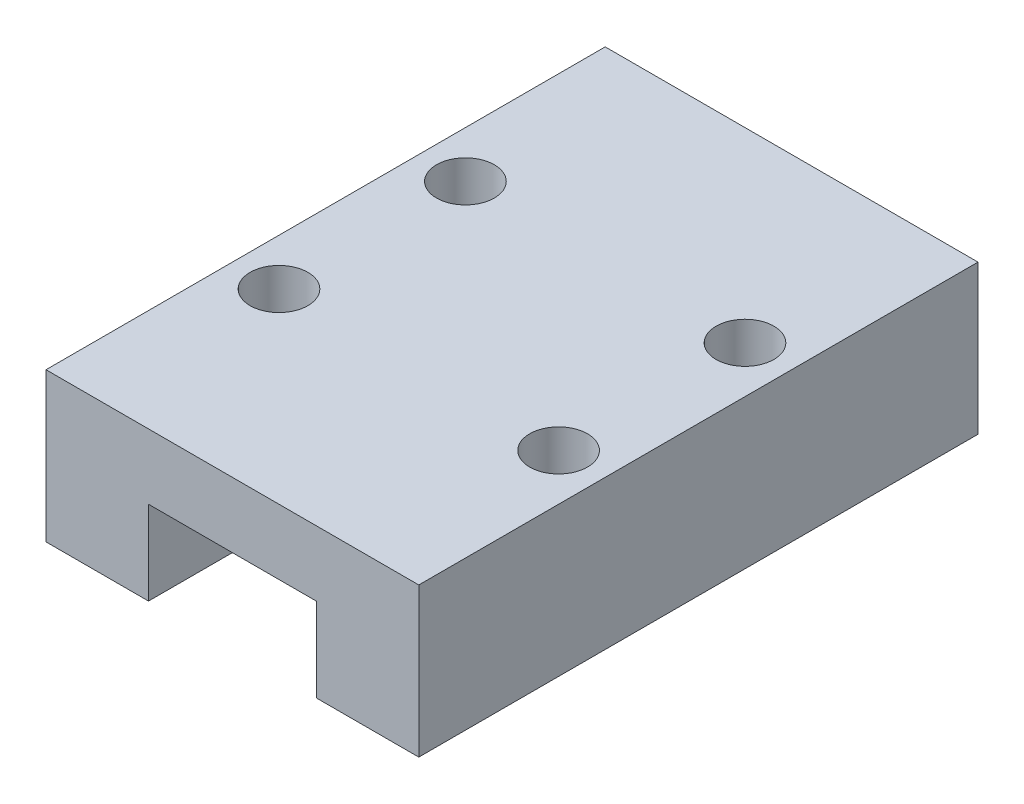
from build123d import *

# Parameters (mm, degrees)
SKETCH_1_W          = 20
SKETCH_1_H          = 30
EXTRUDE_1_DEPTH     = 3.5
SKETCH_2_W          = 5.5
SKETCH_2_H          = 30
EXTRUDE_2_DEPTH     = 4.5
SKETCH_3_R          = 1.55
CUT_EXTRUDE_1_DEPTH = 8


with BuildPart() as part:
    # 草图1 → 凸台-拉伸1 (new body)
    with BuildSketch(Plane(origin=(0, 0, 0), x_dir=(1, 0, 0), z_dir=(0, 1, 0))):
        Rectangle(SKETCH_1_W, SKETCH_1_H)
    extrude(amount=EXTRUDE_1_DEPTH)

    # 草图2 → 凸台-拉伸2 (add)
    with BuildSketch(Plane(origin=(0, 0, 0), x_dir=(-1, 0, 0), z_dir=(0, -1, 0))):
        with Locations((-7.25, 0)):
            Rectangle(SKETCH_2_W, SKETCH_2_H)
        with Locations((7.25, 0)):
            Rectangle(SKETCH_2_W, SKETCH_2_H)
    extrude(amount=EXTRUDE_2_DEPTH)

    # 草图3 → 切除-拉伸1 (cut)
    with BuildSketch(Plane(origin=(0, 3.5, 0), x_dir=(1, 0, 0), z_dir=(0, 1, 0))):
        with Locations(Location((-7.5, -5, 0), (0, 0, 270))):
            Circle(SKETCH_3_R)
        with Locations(Location((-7.5, 5, 0), (0, 0, 270))):
            Circle(SKETCH_3_R)
        with Locations(Location((7.5, 5, 0), (0, 0, 270))):
            Circle(SKETCH_3_R)
        with Locations(Location((7.5, -5, 0), (0, 0, 270))):
            Circle(SKETCH_3_R)
    extrude(amount=-CUT_EXTRUDE_1_DEPTH, mode=Mode.SUBTRACT)


solid = part.part
